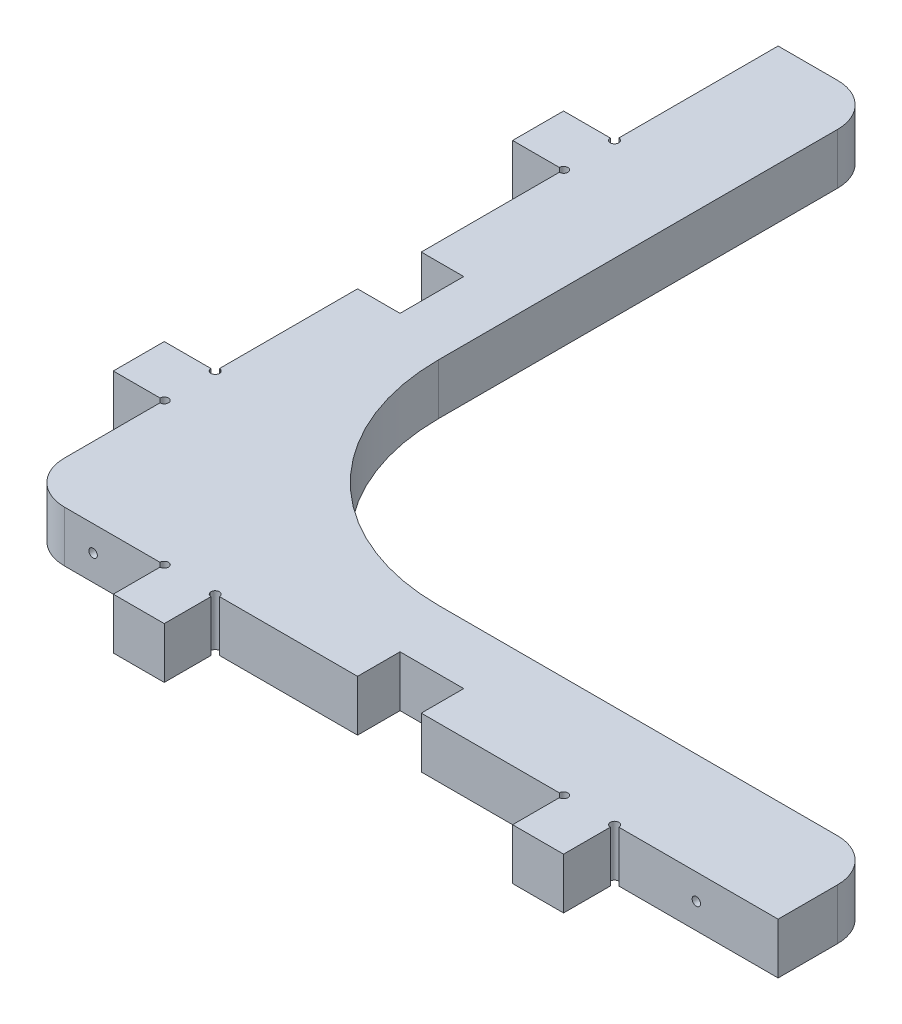
from build123d import *

# Parameters (mm, degrees)
BOSS_EXTRUDE1_DEPTH = 12
SKETCH2_R           = 0.9921875
CUT_EXTRUDE1_DEPTH  = 12
SKETCH3_R           = 0.9921875
CUT_EXTRUDE2_DEPTH  = 12
SKETCH4_R           = 1
CUT_EXTRUDE3_DEPTH  = 219.054378342


with BuildPart() as part:
    # Sketch1 → Boss-Extrude1 (new body)
    with BuildSketch(Plane(origin=(0, 0, 0), x_dir=(1, 0, 0), z_dir=(0, 1, 0))):
        with BuildLine():
            Line((-5.5, 132.84375), (-5.5, 94.34375))
            Line((-5.5, 94.34375), (-17.5, 94.34375))
            Line((-17.5, 94.34375), (-17.5, 82.34375))
            Line((-17.5, 82.34375), (-5.5, 82.34375))
            Line((-5.5, 82.34375), (-5.5, 48.84375))
            Line((-5.5, 48.84375), (4.5, 48.84375))
            Line((4.5, 48.84375), (4.5, 33.84375))
            Line((4.5, 33.84375), (-5.5, 33.84375))
            Line((-5.5, 33.84375), (-5.5, 0.34375))
            Line((-5.5, 0.34375), (-17.5, 0.34375))
            Line((-17.5, 0.34375), (-17.5, -11.65625))
            Line((-17.5, -11.65625), (-5.5, -11.65625))
            Line((-5.5, -11.65625), (-5.5, -35.15625))
            ThreePointArc((-5.5, -35.15625), (-2.571067812, -42.227317812), (4.5, -45.15625))
            Line((4.5, -45.15625), (28, -45.15625))
            Line((28, -45.15625), (28, -57.15625))
            Line((28, -57.15625), (40, -57.15625))
            Line((40, -57.15625), (40, -45.15625))
            Line((40, -45.15625), (73.5, -45.15625))
            Line((73.5, -45.15625), (73.5, -35.15625))
            Line((73.5, -35.15625), (88.5, -35.15625))
            Line((88.5, -35.15625), (88.5, -45.15625))
            Line((88.5, -45.15625), (122, -45.15625))
            Line((122, -45.15625), (122, -57.15625))
            Line((122, -57.15625), (134, -57.15625))
            Line((134, -57.15625), (134, -45.15625))
            Line((134, -45.15625), (172.5, -45.15625))
            Line((172.5, -45.15625), (172.5, -31.15625))
            ThreePointArc((172.5, -31.15625), (169.571067812, -24.085182188), (162.5, -21.15625))
            Line((162.5, -21.15625), (68.5, -21.15625))
            ThreePointArc((68.5, -21.15625), (33.144660941, -6.511589059), (18.5, 28.84375))
            Line((18.5, 28.84375), (18.5, 122.84375))
            ThreePointArc((18.5, 122.84375), (15.571067812, 129.914817812), (8.5, 132.84375))
            Line((8.5, 132.84375), (-5.5, 132.84375))
        make_face()
    extrude(amount=BOSS_EXTRUDE1_DEPTH)

    # Sketch2 → Cut-Extrude1 (cut)
    with BuildSketch(Plane.XY.offset(45.15625)):
        with Locations((153.25, 6)):
            Circle(SKETCH2_R)
        with Locations((11.25, 6)):
            Circle(SKETCH2_R)
    extrude(amount=-CUT_EXTRUDE1_DEPTH, mode=Mode.SUBTRACT)

    # Sketch3 → Cut-Extrude2 (cut)
    with BuildSketch(Plane.ZY.offset(5.5)):
        with Locations((28.40625, 6)):
            Circle(SKETCH3_R)
        with Locations((-113.59375, 6)):
            Circle(SKETCH3_R)
    extrude(amount=-CUT_EXTRUDE2_DEPTH, mode=Mode.SUBTRACT)

    # Sketch4 → Cut-Extrude3 (cut, through all)
    with BuildSketch(Plane(origin=(0, 0, 0), x_dir=(1, 0, 0), z_dir=(0, 1, 0))):
        with Locations((-5.5, 94.34375)):
            Circle(SKETCH4_R)
        with Locations((-5.5, 82.34375)):
            Circle(SKETCH4_R)
        with Locations((-5.5, 0.34375)):
            Circle(SKETCH4_R)
        with Locations((-5.5, -11.65625)):
            Circle(SKETCH4_R)
        with Locations((28, -45.15625)):
            Circle(SKETCH4_R)
        with Locations((40, -45.15625)):
            Circle(SKETCH4_R)
        with Locations((122, -45.15625)):
            Circle(SKETCH4_R)
        with Locations((134, -45.15625)):
            Circle(SKETCH4_R)
    extrude(amount=CUT_EXTRUDE3_DEPTH, mode=Mode.SUBTRACT)


solid = part.part
